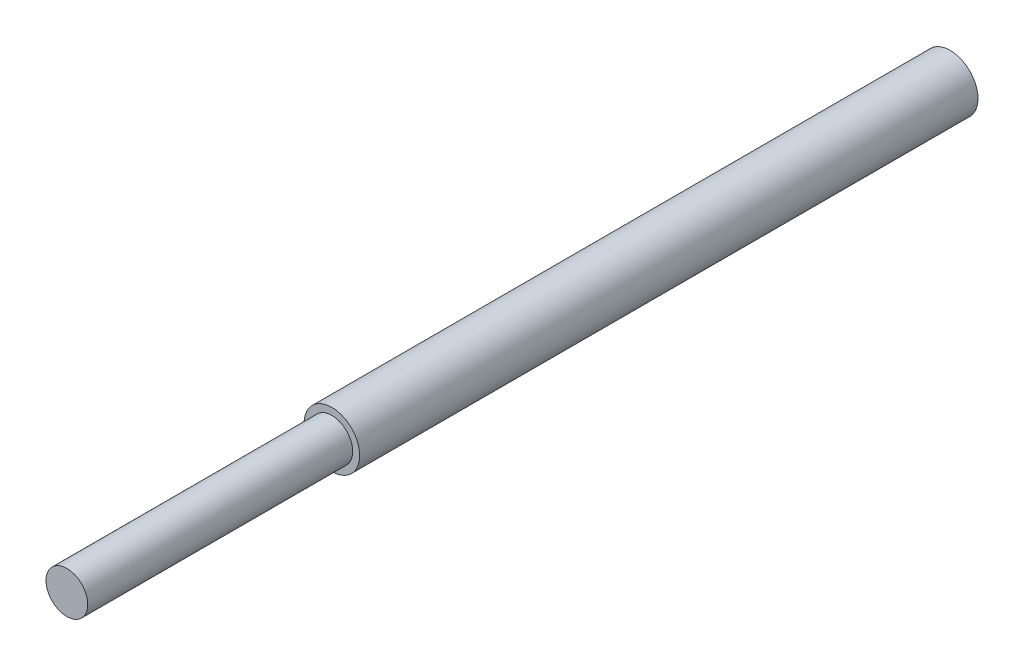
from build123d import *

# Parameters (mm, degrees)
SKETCH1_R           = 4
BOSS_EXTRUDE1_DEPTH = 88.9
SKETCH2_R           = 3
BOSS_EXTRUDE2_DEPTH = 38.1


with BuildPart() as part:
    # Sketch1 → Boss-Extrude1 (new body)
    with BuildSketch(Plane.XY):
        Circle(SKETCH1_R)
    extrude(amount=BOSS_EXTRUDE1_DEPTH)

    # Sketch2 → Boss-Extrude2 (add)
    with BuildSketch(Plane.XY.offset(88.9)):
        with Locations(Location((0, 0, 0), (0, 0, 180))):
            Circle(SKETCH2_R)
    extrude(amount=BOSS_EXTRUDE2_DEPTH)


solid = part.part
